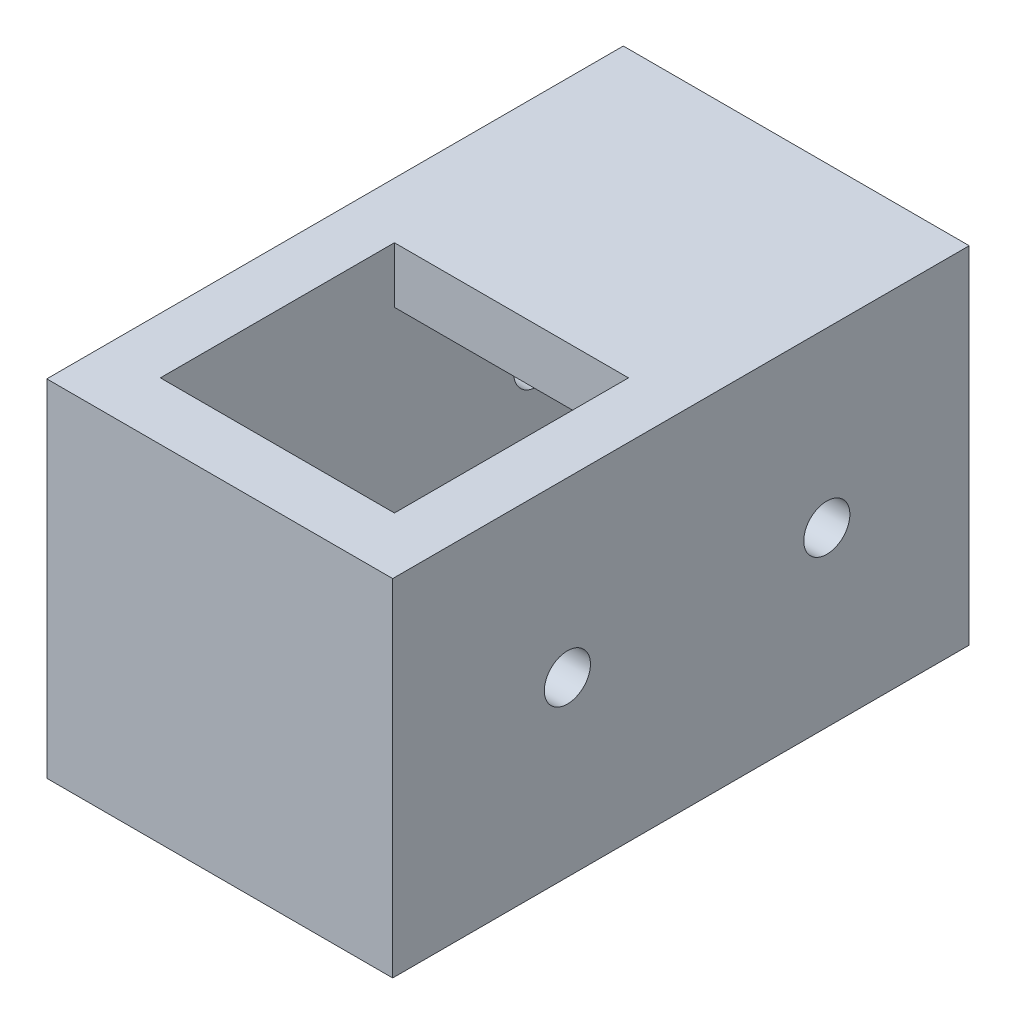
from build123d import *

# Parameters (mm, degrees)
SKETCH1_W           = 30
SKETCH1_H           = 30
BOSS_EXTRUDE1_DEPTH = 50
SKETCH3_W           = 20.3
SKETCH3_H           = 20.3
CUT_EXTRUDE1_DEPTH  = 66.574385243
SKETCH2_W           = 20.3
SKETCH2_H           = 20.3
CUT_EXTRUDE2_DEPTH  = 30
SKETCH5_R           = 2
CUT_EXTRUDE3_DEPTH  = 66.574385243


with BuildPart() as part:
    # Sketch1 → Boss-Extrude1 (new body)
    with BuildSketch(Plane.XY):
        with Locations((15, 15)):
            Rectangle(SKETCH1_W, SKETCH1_H)
    extrude(amount=BOSS_EXTRUDE1_DEPTH)

    # Sketch3 → Cut-Extrude1 (cut, through all)
    with BuildSketch(Plane(origin=(0, 30, 0), x_dir=(1, 0, 0), z_dir=(0, 1, 0))):
        with Locations((15, -34.85)):
            Rectangle(SKETCH3_W, SKETCH3_H)
    extrude(amount=-CUT_EXTRUDE1_DEPTH, mode=Mode.SUBTRACT)

    # Sketch2 → Cut-Extrude2 (cut)
    with BuildSketch(Plane(origin=(0, 0, 0), x_dir=(-1, 0, 0), z_dir=(0, 0, -1))):
        with Locations((-15, 15)):
            Rectangle(SKETCH2_W, SKETCH2_H)
    extrude(amount=-CUT_EXTRUDE2_DEPTH, mode=Mode.SUBTRACT)

    # Sketch5 → Cut-Extrude3 (cut, through all)
    with BuildSketch(Plane.ZY):
        with Locations((34.85, 15)):
            Circle(SKETCH5_R)
        with Locations((12.35, 15)):
            Circle(SKETCH5_R)
    extrude(amount=-CUT_EXTRUDE3_DEPTH, mode=Mode.SUBTRACT)


solid = part.part
